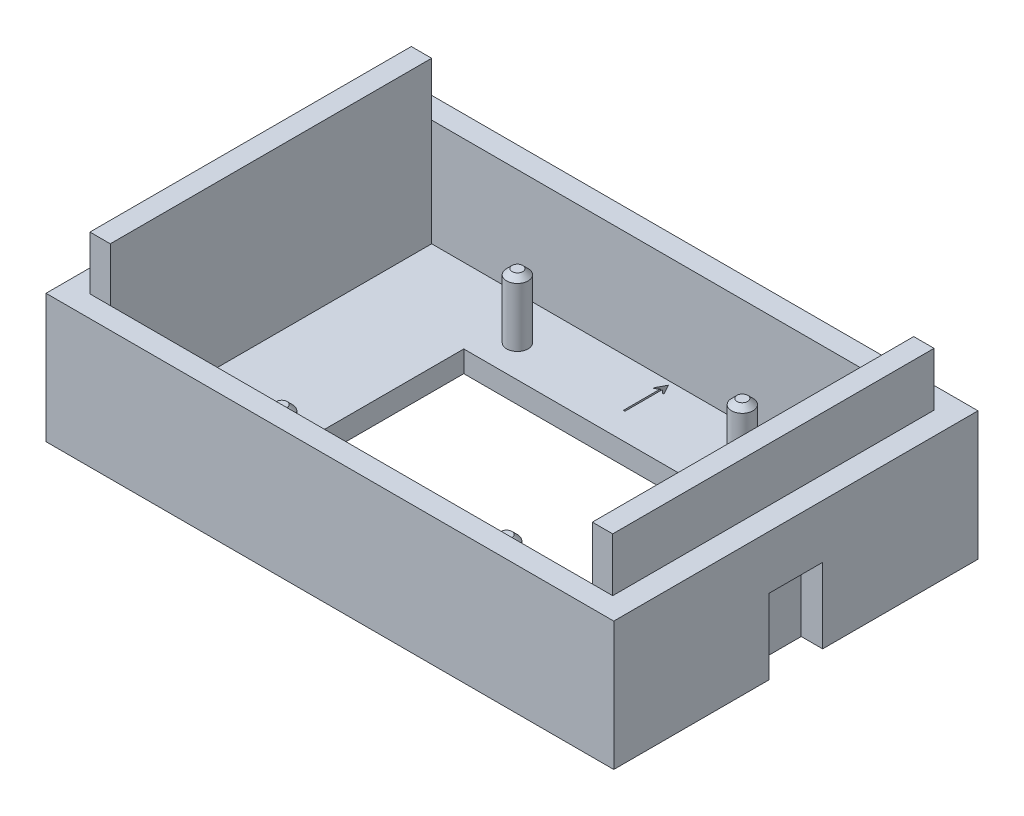
from build123d import *

# Parameters (mm, degrees)
SKETCH_1_W                         = 29
SKETCH_1_H                         = 30
SKETCH_1_W_2                       = 25
SKETCH_1_H_2                       = 17
EXTRUDE_1_DEPTH                    = 2
SKETCH_4_R                         = 1
EXTRUDE_2_DEPTH                    = 6
CHAMFER_1_SIZE                     = 0.5
PATTERN_LINEAR_1_COUNT             = 2
PATTERN_LINEAR_1_PITCH             = 21
PATTERN_LINEAR_1_COUNT_DIR2        = 2
PATTERN_LINEAR_1_PITCH_DIR2        = 22
CHAMFER_1_OF_PATTERN_LINEAR_1_SIZE = 0.5
SKETCH_5_W                         = 53
SKETCH_5_H                         = 34
SKETCH_5_W_2                       = 29
SKETCH_5_H_2                       = 30
EXTRUDE_3_DEPTH                    = 2
SKETCH_6_W                         = 53
SKETCH_6_H                         = 34
SKETCH_6_W_2                       = 45
SKETCH_6_H_2                       = 30
EXTRUDE_4_DEPTH                    = 10
SKETCH_7_W                         = 1.9
SKETCH_7_H                         = 30
EXTRUDE_5_DEPTH                    = 5
SKETCH_8_W                         = 5
SKETCH_8_H                         = 7
CUT_EXTRUDE_1_DEPTH                = 2
CUT_EXTRUDE_2_DEPTH                = 1


with BuildPart() as part:
    # 草图1 → 凸台-拉伸1 (new body)
    with BuildSketch(Plane(origin=(0, 0, 0), x_dir=(1, 0, 0), z_dir=(0, 1, 0))):
        with Locations((14.5, 15)):
            Rectangle(SKETCH_1_W, SKETCH_1_H)
        with Locations((14.5, 14.5)):
            Rectangle(SKETCH_1_W_2, SKETCH_1_H_2, mode=Mode.SUBTRACT)
    extrude(amount=EXTRUDE_1_DEPTH)

    # 草图4 → 凸台-拉伸2 (add)
    with BuildSketch(Plane(origin=(0, 2, 0), x_dir=(1, 0, 0), z_dir=(0, 1, 0))):
        with Locations(Location((4, 26, 0), (0, 0, 90))):
            Circle(SKETCH_4_R)
    extrude_2 = extrude(amount=EXTRUDE_2_DEPTH)

    # 倒角1
    chamfer_1_edges = [part.edges().sort_by_distance(p)[0] for p in [
        (4, 8, -25),
    ]]
    chamfer(chamfer_1_edges, length=CHAMFER_1_SIZE)

    # 阵列(线性)1: Extrude 2 2 × 2
    with Locations(*[(i * PATTERN_LINEAR_1_PITCH, 0, j * PATTERN_LINEAR_1_PITCH_DIR2) for i in range(PATTERN_LINEAR_1_COUNT) for j in range(PATTERN_LINEAR_1_COUNT_DIR2) if (i, j) != (0, 0)]):
        add(extrude_2)

    # 倒角1 of 阵列(线性)1
    chamfer_1_of_pattern_linear_1_edges = [part.edges().sort_by_distance(p)[0] for p in [
        (4, 8, -3),
        (25, 8, -25),
        (25, 8, -3),
    ]]
    chamfer(chamfer_1_of_pattern_linear_1_edges, length=CHAMFER_1_OF_PATTERN_LINEAR_1_SIZE)

    # 草图5 → 凸台-拉伸3 (add)
    with BuildSketch(Plane.XZ):
        with Locations((14.5, -15)):
            Rectangle(SKETCH_5_W, SKETCH_5_H)
        with Locations((14.5, -15)):
            Rectangle(SKETCH_5_W_2, SKETCH_5_H_2, mode=Mode.SUBTRACT)
    extrude(amount=-EXTRUDE_3_DEPTH)

    # 草图6 → 凸台-拉伸4 (add)
    with BuildSketch(Plane(origin=(0, 2, 0), x_dir=(1, 0, 0), z_dir=(0, 1, 0))):
        with Locations((14.5, 15)):
            Rectangle(SKETCH_6_W, SKETCH_6_H)
        with Locations((14.5, 15)):
            Rectangle(SKETCH_6_W_2, SKETCH_6_H_2, mode=Mode.SUBTRACT)
    extrude(amount=EXTRUDE_4_DEPTH)

    # 草图7 → 凸台-拉伸5 (add)
    with BuildSketch(Plane(origin=(0, 12, 0), x_dir=(1, 0, 0), z_dir=(0, 1, 0))):
        with Locations((-8.95, 15)):
            Rectangle(SKETCH_7_W, SKETCH_7_H)
        with Locations((37.95, 15)):
            Rectangle(SKETCH_7_W, SKETCH_7_H)
    extrude(amount=EXTRUDE_5_DEPTH)

    # 草图8 → 切除-拉伸1 (cut)
    with BuildSketch(Plane.ZY.offset(12)):
        with Locations((-15, 3.5)):
            Rectangle(SKETCH_8_W, SKETCH_8_H)
    cut_extrude_1 = extrude(amount=-CUT_EXTRUDE_1_DEPTH, mode=Mode.SUBTRACT)

    # 草图9 → 切除-拉伸2 (cut)
    with BuildSketch(Plane(origin=(0, 2, 0), x_dir=(1, 0, 0), z_dir=(0, 1, 0))):
        with BuildLine():
            Line((14.558917537, 25.486895376), (14.412742382, 25.486895376))
            Line((14.412742382, 25.486895376), (14.412742382, 28.945131046))
            Line((14.412742382, 28.945131046), (14.141274238, 28.708715108))
            add(Edge.make_bspline(
                [(14.141274238, 28.708715108), (14.131226678, 28.699624795), (14.111776808, 28.682027946), (14.078955395, 28.667696389), (14.049596625, 28.660757409), (14.025482894, 28.674909055), (14.024334353, 28.706256057), (14.027312724, 28.742599315), (14.035982745, 28.785479878), (14.049247389, 28.811861074), (14.055508204, 28.824312806)],
                knots=[0, 0, 0, 0, 1.145827462, 2.218070327, 3.049383638, 3.602329049, 4.338402789, 5.486582277, 6.813685142, 8, 8, 8, 8], degree=3))
            Line((14.055508204, 28.824312806), (14.478372043, 29.619326657))
            Line((14.478372043, 29.619326657), (14.911676966, 28.849669721))
            add(Edge.make_bspline(
                [(14.911676966, 28.849669721), (14.920492206, 28.831763899), (14.93731818, 28.7975864), (14.949542857, 28.753205391), (14.955311509, 28.721793647), (14.95568764, 28.70307516), (14.95245501, 28.688159671), (14.942591019, 28.675147665), (14.922248283, 28.667540916), (14.896003584, 28.678587323), (14.868455455, 28.697222198), (14.850537253, 28.714349218), (14.840826763, 28.72363094)],
                knots=[0, 0, 0, 0, 1.968558185, 3.757459298, 4.529049772, 5.118788489, 5.601560465, 6.004578554, 6.689087708, 7.559937433, 8.677646168, 10, 10, 10, 10], degree=3))
            Line((14.840826763, 28.72363094), (14.558917537, 28.960046878))
            Line((14.558917537, 28.960046878), (14.558917537, 25.486895376))
        make_face()
    extrude(amount=-CUT_EXTRUDE_2_DEPTH, mode=Mode.SUBTRACT)

    # 镜向1: 切除-拉伸1 across plane
    add(cut_extrude_1.mirror(Plane.ZY.offset(-14.5)), mode=Mode.SUBTRACT)


solid = part.part
